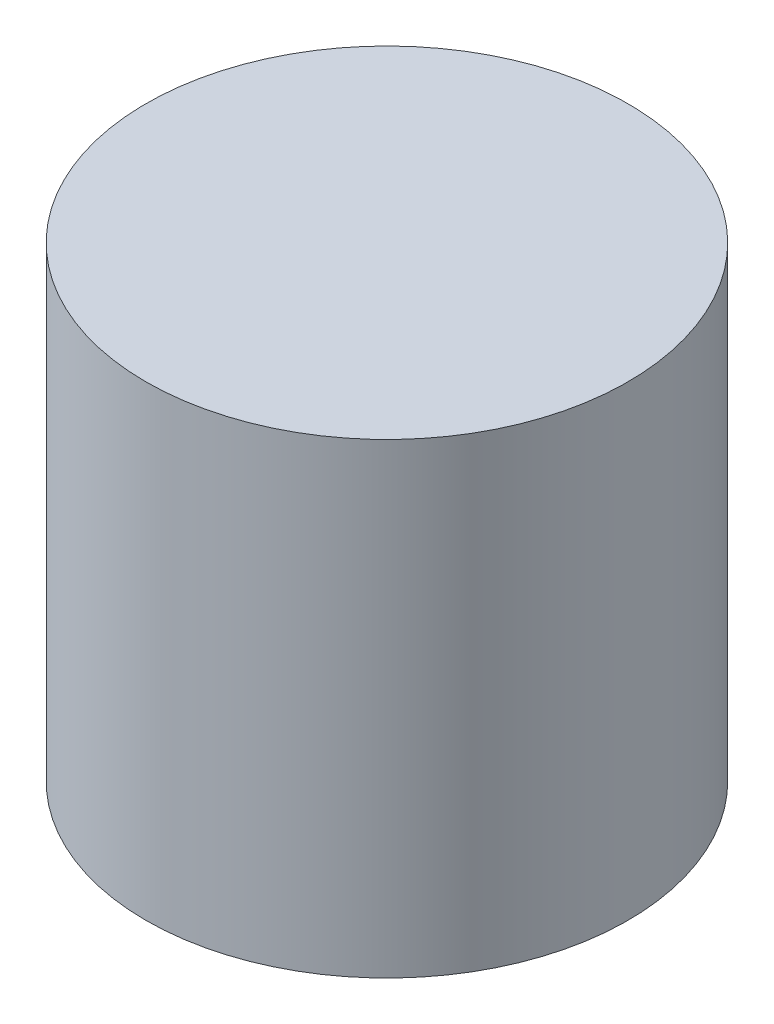
from build123d import *

# Parameters (mm, degrees)
SKETCH1_R           = 3.1
SKETCH1_R_2         = 1.975
BOSS_EXTRUDE1_DEPTH = 6
SKETCH1_4_R         = 1.975
CUT_EXTRUDE1_DEPTH  = 4


with BuildPart() as part:
    # Sketch1 → Boss-Extrude1 (new body)
    # profile 1 of 2: a face of its own
    with BuildSketch(Plane(origin=(0, 0, 0), x_dir=(1, 0, 0), z_dir=(0, 1, 0))):
        with Locations(Location((0, 0, 0), (0, 0, 270))):
            Circle(SKETCH1_R)
        Circle(SKETCH1_R_2, mode=Mode.SUBTRACT)
    # profile 2 of 2: a face of its own
    with BuildSketch(Plane(origin=(0, 0, 0), x_dir=(1, 0, 0), z_dir=(0, 1, 0))):
        Circle(SKETCH1_R_2)
    extrude(amount=BOSS_EXTRUDE1_DEPTH)

    # Sketch1<4> → Cut-Extrude1 (cut)
    with BuildSketch(Plane(origin=(0, 0, 0), x_dir=(1, 0, 0), z_dir=(0, 1, 0))):
        with Locations(Location((0, 0, 0), (0, 0, 270))):
            Circle(SKETCH1_4_R)
    extrude(amount=CUT_EXTRUDE1_DEPTH, mode=Mode.SUBTRACT)


solid = part.part
